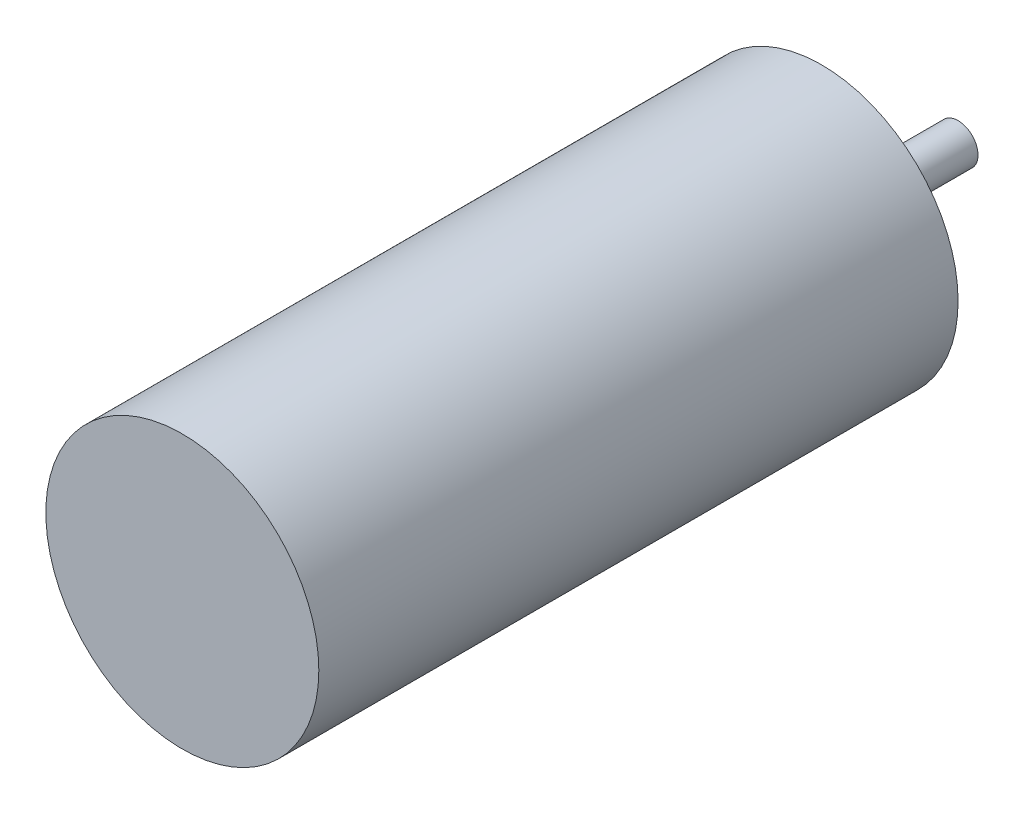
from build123d import *

# Parameters (mm, degrees)
SKETCH1_R           = 12
BOSS_EXTRUDE1_DEPTH = 56.2
SKETCH2_R           = 1.75
BOSS_EXTRUDE2_DEPTH = 12


with BuildPart() as part:
    # Sketch1 → Boss-Extrude1 (new body)
    with BuildSketch(Plane.XY):
        Circle(SKETCH1_R)
    extrude(amount=BOSS_EXTRUDE1_DEPTH)

    # Sketch2 → Boss-Extrude2 (add)
    with BuildSketch(Plane(origin=(0, 0, 0), x_dir=(-1, 0, 0), z_dir=(0, 0, -1))):
        with Locations(Location((0, 0, 0), (0, 0, 180))):
            Circle(SKETCH2_R)
    extrude(amount=BOSS_EXTRUDE2_DEPTH)


solid = part.part
